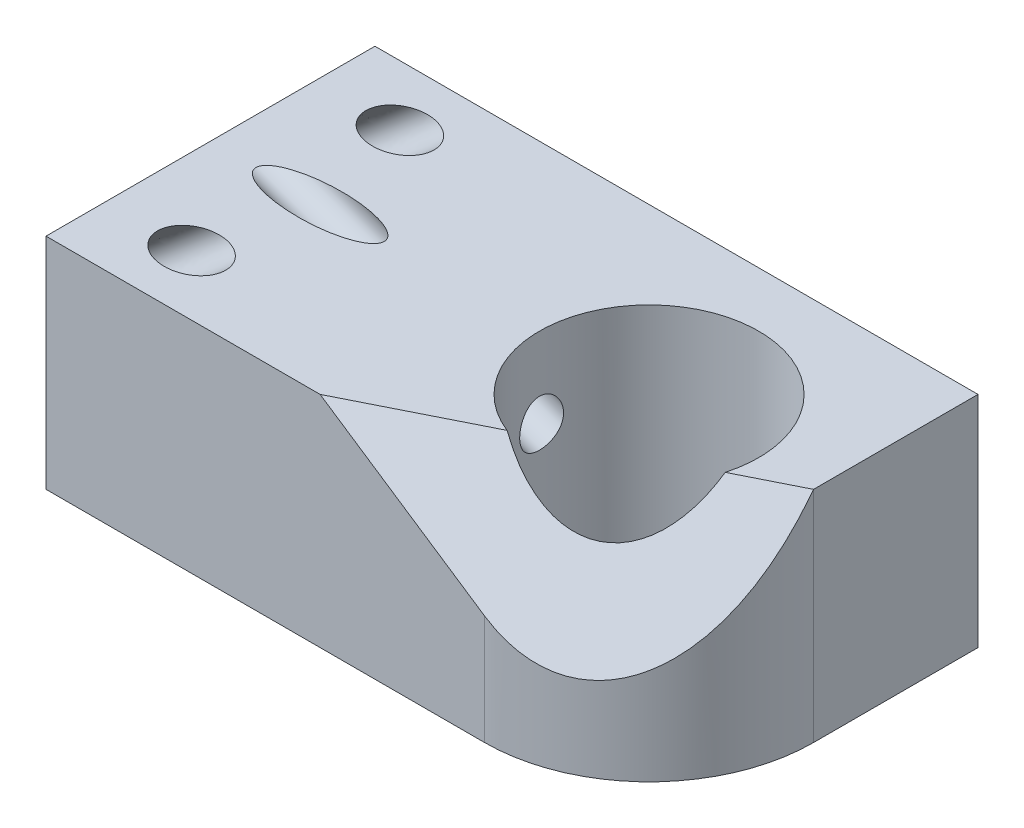
from build123d import *

# Parameters (mm, degrees)
SKETCH1_R               = 25.4
BOSS_EXTRUDE1_DEPTH     = 50.8
SKETCH3_R               = 57.740846599
CUT_EXTRUDE1_DEPTH      = 124.114128787
SKETCH4_RX              = 6.35
SKETCH4_RY              = 5.08
CUT_EXTRUDE2_DEPTH      = 152.575785835
CUT_EXTRUDE3_REACH      = 157.303
CUT_EXTRUDE3_END_RADIUS = 25.4
SKETCH6_R               = 5.08


with BuildPart() as part:
    # Sketch1 → Boss-Extrude1 (new body)
    with BuildSketch(Plane(origin=(0, 0, 0), x_dir=(1, 0, 0), z_dir=(0, 1, 0))):
        with BuildLine():
            Line((-69.85, -38.1), (31.75, -38.1))
            ThreePointArc((31.75, -38.1), (58.690768363, -26.940768363), (69.85, 0))
            Line((69.85, 0), (69.85, 38.1))
            Line((69.85, 38.1), (-69.85, 38.1))
            Line((-69.85, 38.1), (-69.85, -38.1))
        make_face()
        with Locations(Location((31.75, 0, 0), (0, 0, 270))):
            Circle(SKETCH1_R, mode=Mode.SUBTRACT)
    extrude(amount=BOSS_EXTRUDE1_DEPTH)

    # Sketch3 → Cut-Extrude1 (cut, through all)
    with BuildSketch(Plane(origin=(20.144827586, 30.217241379, 40.289655172), x_dir=(0.928476690885259, -0.22283440581246322, -0.2971125410832833), z_dir=(0.3713906763541046, 0.5570860145311567, 0.7427813527082063))):
        with Locations((6.839159305, 17.78)):
            Circle(SKETCH3_R)
    extrude(amount=CUT_EXTRUDE1_DEPTH, mode=Mode.SUBTRACT)

    # Sketch4 → Cut-Extrude2 (cut, through all)
    with BuildSketch(Plane(origin=(66.003779532, 55.383747061, 0), x_dir=(0, 0, -1), z_dir=(0.7660444431189792, 0.6427876096865379, 0))):
        with Locations((-24.13, 71.113772247)):
            Ellipse(SKETCH4_RX, SKETCH4_RY)
        with Locations((24.13, 71.113772247)):
            Ellipse(SKETCH4_RX, SKETCH4_RY)
    extrude(amount=-CUT_EXTRUDE2_DEPTH, mode=Mode.SUBTRACT)

    # Cut-Extrude3: up to this cylinder (the profile starts outside it)
    cut_extrude3_end = Plane(origin=(31.75, 58.963403, 0), z_dir=(0, -1, 0)) * Cylinder(CUT_EXTRUDE3_END_RADIUS, 366.406, mode=Mode.PRIVATE)
    # Sketch6 → Cut-Extrude3 (cut, up to the surface)
    with BuildSketch(Plane(origin=(-78.005907462, 28.391828413, 0), x_dir=(0, 0, 1), z_dir=(-0.9396926207859093, 0.34202014332566605, 0)), mode=Mode.PRIVATE) as cut_extrude3_sk1:
        with Locations(Location((0, 32.533589765, 0), (0, 0, 270))):
            Circle(SKETCH6_R)
    cut_extrude3_tool1 = extrude(cut_extrude3_sk1.sketch, amount=-CUT_EXTRUDE3_REACH, mode=Mode.PRIVATE) - cut_extrude3_end
    add(cut_extrude3_tool1.solids().sort_by_distance((-66.878764, 58.963403, 0))[0], mode=Mode.SUBTRACT)


solid = part.part
